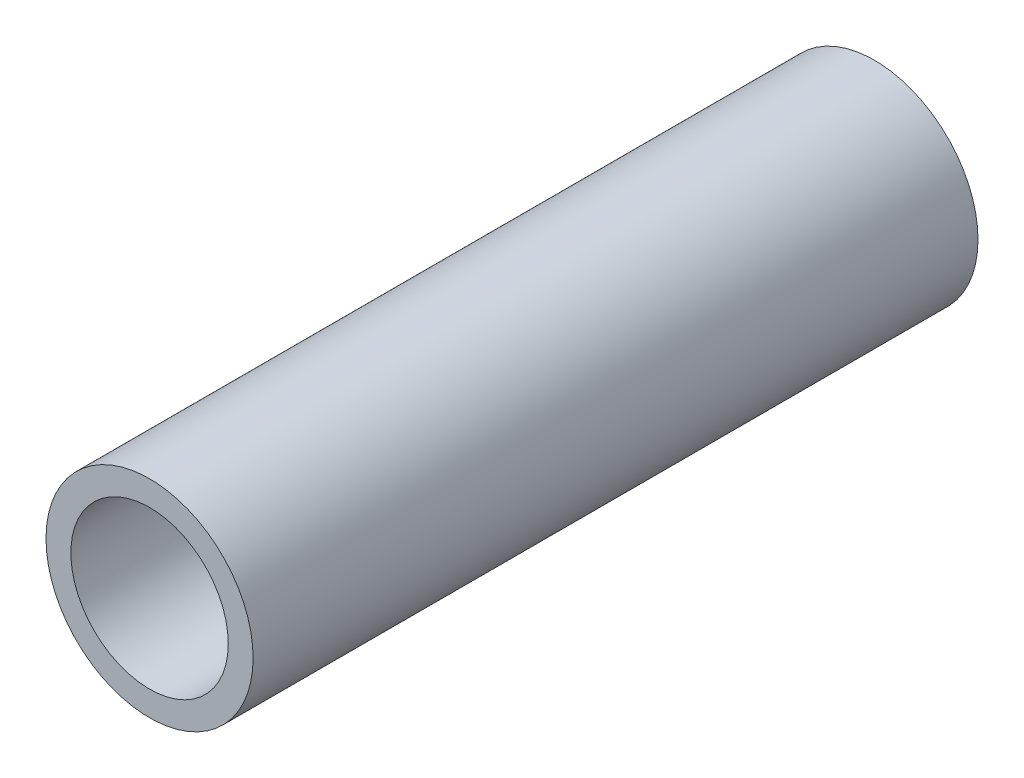
from build123d import *

# Parameters (mm, degrees)
SKETCH2_R           = 10
SKETCH2_R_2         = 6.1
BOSS_EXTRUDE1_DEPTH = 25
SKETCH3_R           = 10
BOSS_EXTRUDE2_DEPTH = 45
SKETCH4_R           = 7.6
CUT_EXTRUDE1_DEPTH  = 45


with BuildPart() as part:
    # Sketch2 → Boss-Extrude1 (new body)
    with BuildSketch(Plane.XY):
        Circle(SKETCH2_R)
        Circle(SKETCH2_R_2, mode=Mode.SUBTRACT)
    extrude(amount=BOSS_EXTRUDE1_DEPTH)

    # Sketch3 → Boss-Extrude2 (add)
    with BuildSketch(Plane.XY.offset(25)):
        Circle(SKETCH3_R)
    extrude(amount=BOSS_EXTRUDE2_DEPTH)

    # Sketch4 → Cut-Extrude1 (cut)
    with BuildSketch(Plane.XY.offset(70)):
        Circle(SKETCH4_R)
    extrude(amount=-CUT_EXTRUDE1_DEPTH, mode=Mode.SUBTRACT)


solid = part.part
